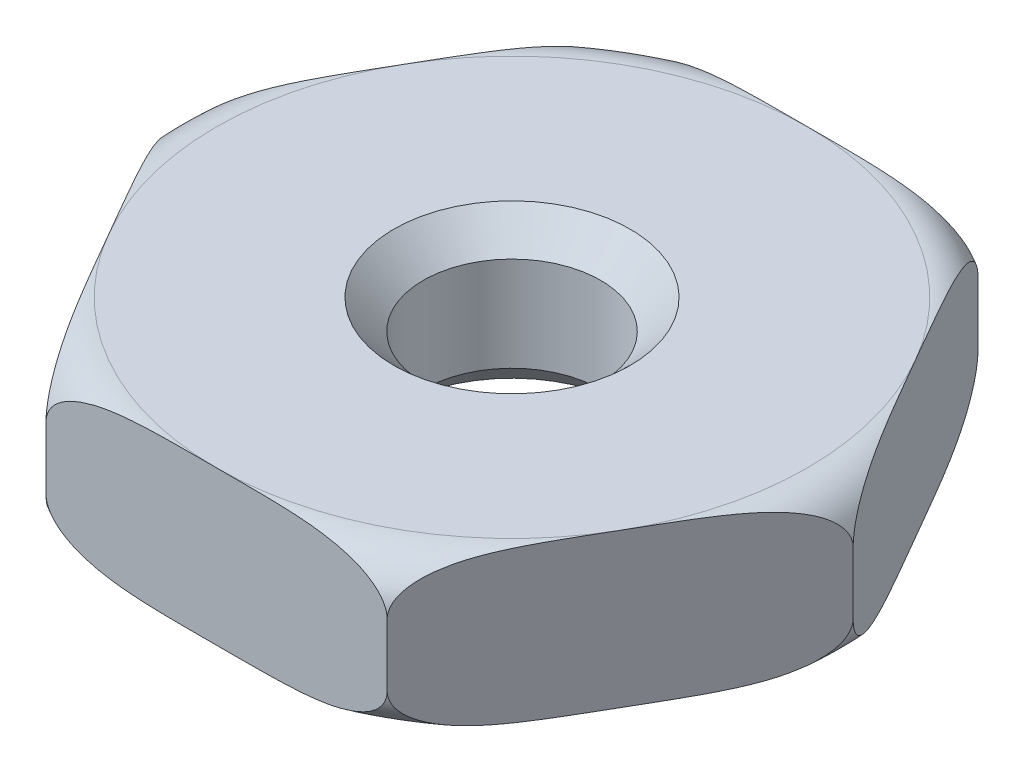
from build123d import *

# Parameters (mm, degrees)
BOSS_EXTRUDE1_DEPTH = 0.325
SKETCH6_R           = 0.375
CUT_EXTRUDE1_DEPTH  = 3.017011156
CHAMFER1_SIZE       = 0.125


with BuildPart() as part:
    # Sketch1 → Boss-Extrude1 (new, symmetric)
    with BuildSketch(Plane(origin=(0, 0, 0), x_dir=(1, 0, 0), z_dir=(0, 1, 0))):
        Polygon((1.443375673, 0), (0.721687836, 1.25), (-0.721687836, 1.25), (-1.443375673, 0), (-0.721687836, -1.25), (0.721687836, -1.25), align=None)
    extrude(amount=BOSS_EXTRUDE1_DEPTH, both=True)

    # Sketch3 → Cut-Revolve1 (revolve, cut)
    with BuildSketch(Plane.XY):
        with BuildLine():
            Line((-1.443375673, 0.325), (-1.443375673, 0.131624327))
            ThreePointArc((-1.443375673, 0.131624327), (-1.38673725, 0.268361577), (-1.25, 0.325))
            Line((-1.25, 0.325), (-1.443375673, 0.325))
        make_face()
    cut_revolve1 = revolve(axis=Axis((0, 0, 0), (0, -1, 0)), mode=Mode.SUBTRACT)

    # Mirror1: Cut-Revolve1 across plane
    add(cut_revolve1.mirror(Plane.ZX), mode=Mode.SUBTRACT)

    # Sketch6 → Cut-Extrude1 (cut, through all)
    with BuildSketch(Plane(origin=(0, 0.325, 0), x_dir=(1, 0, 0), z_dir=(0, 1, 0))):
        with Locations(Location((0, 0, 0), (0, 0, 270))):
            Circle(SKETCH6_R)
    extrude(amount=-CUT_EXTRUDE1_DEPTH, mode=Mode.SUBTRACT)

    # Chamfer1
    chamfer1_edges = [part.edges().sort_by_distance(p)[0] for p in [
        (0, -0.325, -0.375),
        (0, 0.325, -0.375),
    ]]
    chamfer(chamfer1_edges, length=CHAMFER1_SIZE)


solid = part.part
